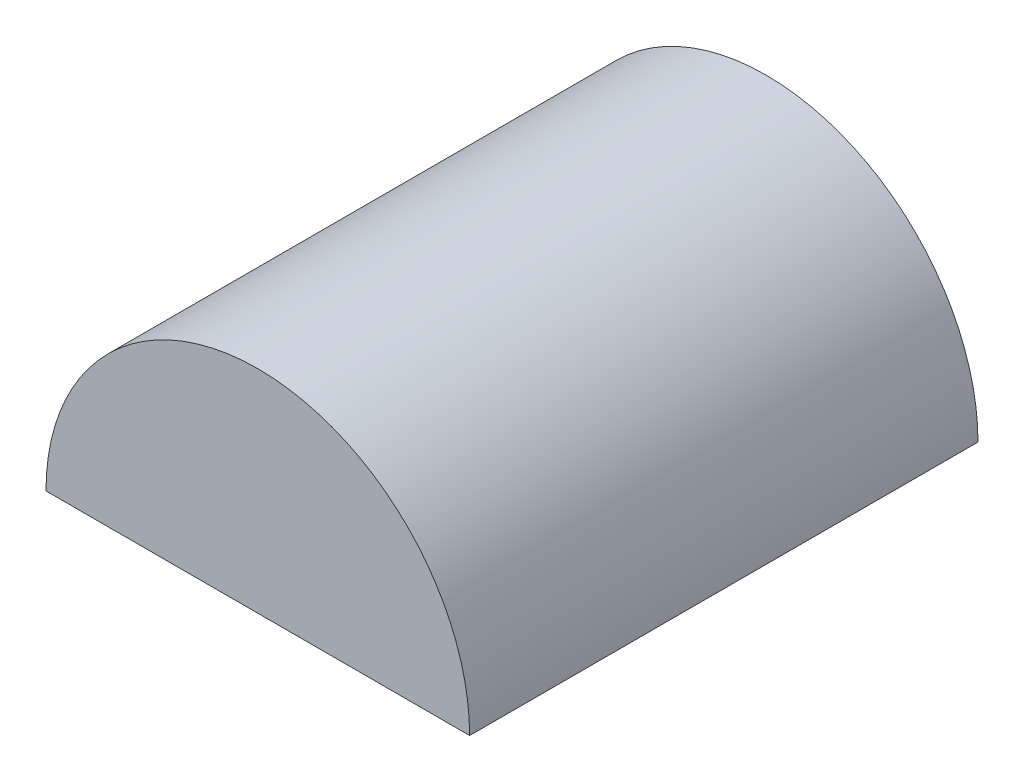
from build123d import *

# Parameters (mm, degrees)
BOSS_EXTRUDE1_DEPTH = 0.6


with BuildPart() as part:
    # Sketch1 → Boss-Extrude1 (new body)
    with BuildSketch(Plane.XY):
        with BuildLine():
            Line((0, 0), (-0.25, 0))
            ThreePointArc((-0.25, 0), (0, 0.25), (0.25, 0))
            Line((0.25, 0), (0, 0))
        make_face()
    extrude(amount=BOSS_EXTRUDE1_DEPTH)


solid = part.part
